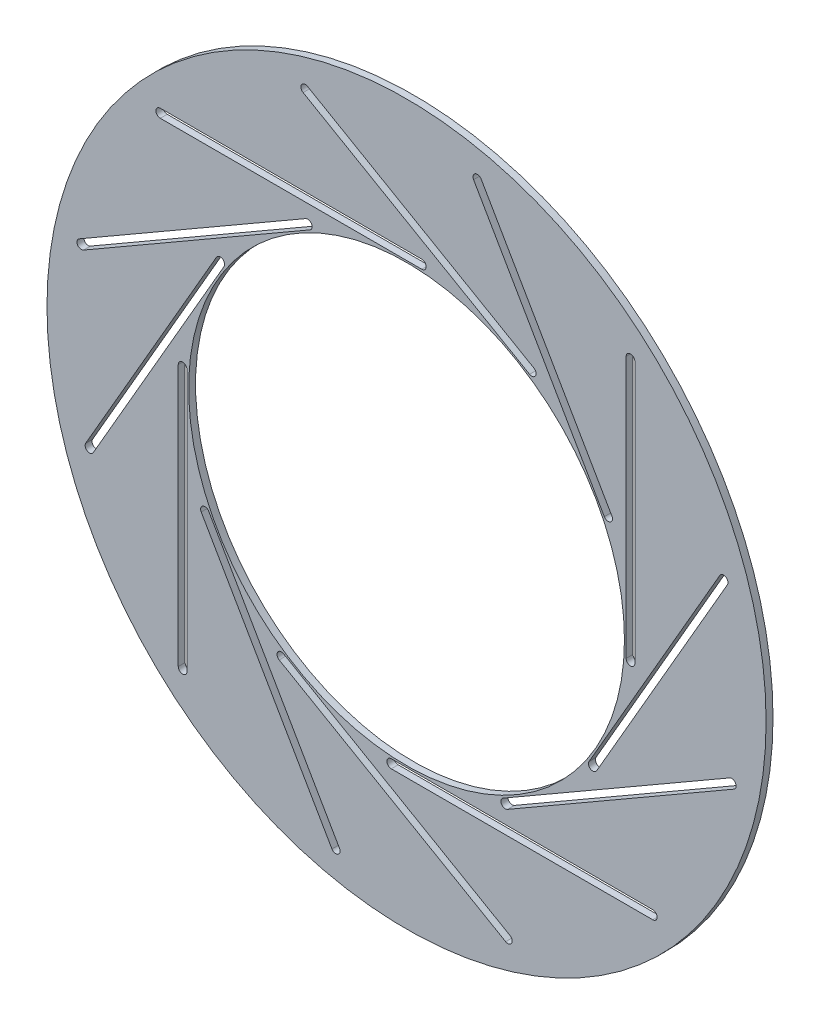
from build123d import *

# Parameters (mm, degrees)
SKETCH1_R           = 165
SKETCH1_R_2         = 100
BOSS_EXTRUDE1_DEPTH = 3.175
CUT_EXTRUDE1_DEPTH  = 3.175
CIRPATTERN1_COUNT   = 12


with BuildPart() as part:
    # Sketch1 → Boss-Extrude1 (new body)
    with BuildSketch(Plane.XY):
        Circle(SKETCH1_R)
        Circle(SKETCH1_R_2, mode=Mode.SUBTRACT)
    extrude(amount=BOSS_EXTRUDE1_DEPTH)

    # Sketch2 → Cut-Extrude1 (cut)
    with BuildSketch(Plane.XY.offset(3.175)):
        with BuildLine():
            Line((-113, 104.761860629), (7, 104.761860629))
            ThreePointArc((7, 104.761860629), (9, 102.761860629), (7, 100.761860629))
            Line((7, 100.761860629), (-113, 100.761860629))
            ThreePointArc((-113, 100.761860629), (-115, 102.761860629), (-113, 104.761860629))
        make_face()
    cut_extrude1 = extrude(amount=-CUT_EXTRUDE1_DEPTH, mode=Mode.SUBTRACT)

    # CirPattern1: Cut-Extrude1 ×12 about axis
    cirpattern1_axis = Axis((0, 0, 0), (0, 0, 1))
    for i in range(1, CIRPATTERN1_COUNT):
        add(cut_extrude1.rotate(cirpattern1_axis, i * 360 / CIRPATTERN1_COUNT), mode=Mode.SUBTRACT)


solid = part.part
